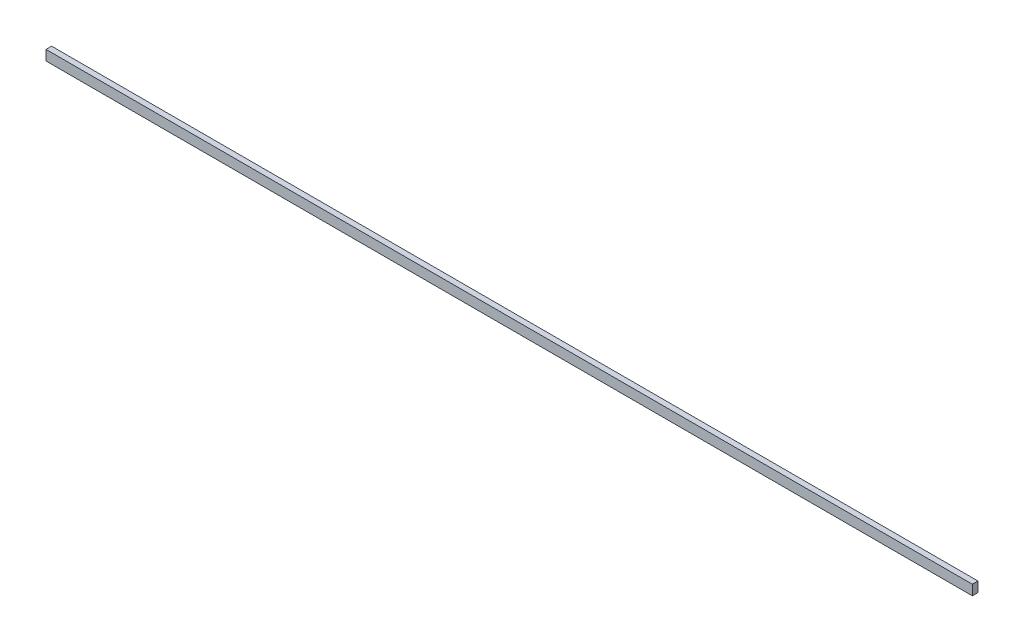
from build123d import *

# Parameters (mm, degrees)
SKETCH_2_W      = 461.2
SKETCH_2_H      = 5
EXTRUDE_1_DEPTH = 1.4


with BuildPart() as part:
    # Эскиз2 → Бобышка-Вытянуть1 (new, symmetric)
    with BuildSketch(Plane.XY):
        Rectangle(SKETCH_2_W, SKETCH_2_H)
    extrude(amount=EXTRUDE_1_DEPTH, both=True)


solid = part.part
